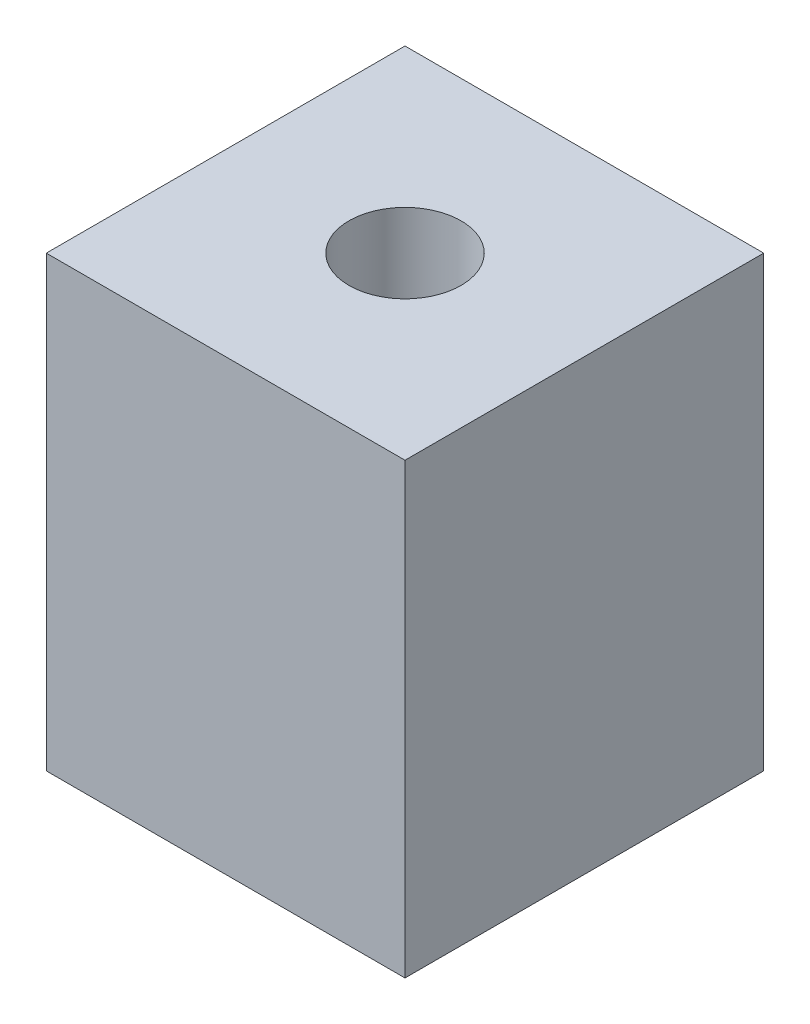
from build123d import *

# Parameters (mm, degrees)
SKETCH_1_R          = 6
EXTRUDE_1_DEPTH     = 40
SKETCH_2_R          = 5
CUT_EXTRUDE_2_DEPTH = 30
SKETCH_3_R          = 2.5
CUT_EXTRUDE_4_DEPTH = 10
SKETCH_5_R          = 16
SKETCH_5_R_2        = 6
EXTRUDE_1_2_DEPTH   = 40
SKETCH_6_W          = 32
SKETCH_6_H          = 32
SKETCH_6_W_2        = 12
SKETCH_6_H_2        = 12
EXTRUDE_2_DEPTH     = 40


with BuildPart() as part:
    # 草圖1 → Extrude 1 (new body)
    with BuildSketch(Plane(origin=(0, 0, 0), x_dir=(1, 0, 0), z_dir=(0, 1, 0))):
        with Locations(Location((0, 0, 0), (0, 0, 270))):
            Circle(SKETCH_1_R)
    extrude(amount=EXTRUDE_1_DEPTH)

    # 草圖2 → 除料-伸長2 (cut)
    with BuildSketch(Plane(origin=(0, 40, 0), x_dir=(1, 0, 0), z_dir=(0, 1, 0))):
        with Locations(Location((0, 0, 0), (0, 0, 270))):
            Circle(SKETCH_2_R)
    extrude(amount=-CUT_EXTRUDE_2_DEPTH, mode=Mode.SUBTRACT)

    # 草圖3 → 除料-伸長4 (cut)
    with BuildSketch(Plane.XZ):
        with Locations(Location((0, 0, 0), (0, 0, 270))):
            Circle(SKETCH_3_R)
    extrude(amount=-CUT_EXTRUDE_4_DEPTH, mode=Mode.SUBTRACT)

    # 草圖5 → Extrude 1 2 (add)
    with BuildSketch(Plane(origin=(0, 0, 0), x_dir=(1, 0, 0), z_dir=(0, 1, 0))):
        Circle(SKETCH_5_R)
        Circle(SKETCH_5_R_2, mode=Mode.SUBTRACT)
    extrude(amount=EXTRUDE_1_2_DEPTH)

    # 草圖6 → 伸長-薄件2 (add)
    with BuildSketch(Plane(origin=(0, 40, 0), x_dir=(1, 0, 0), z_dir=(0, 1, 0))):
        Rectangle(SKETCH_6_W, SKETCH_6_H)
        Rectangle(SKETCH_6_W_2, SKETCH_6_H_2, mode=Mode.SUBTRACT)
    extrude(amount=-EXTRUDE_2_DEPTH)


solid = part.part
